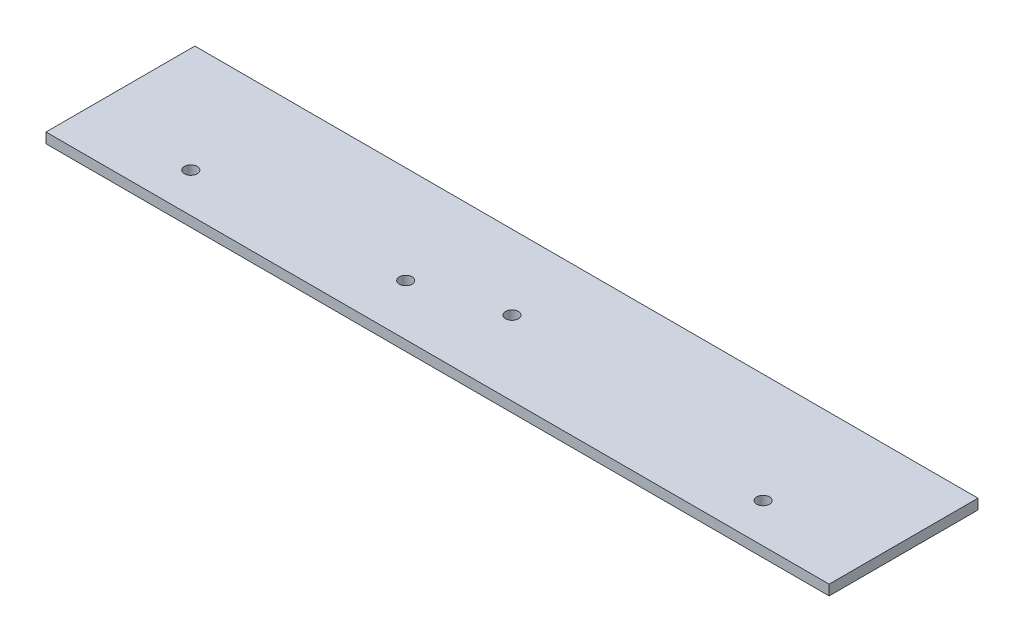
from build123d import *

# Parameters (mm, degrees)
SKETCH1_W           = 194.300874916
SKETCH1_H           = 36.931173376
SKETCH1_R           = 1.5875
BOSS_EXTRUDE1_DEPTH = 1.27


with BuildPart() as part:
    # Sketch1 → Boss-Extrude1 (new, symmetric)
    with BuildSketch(Plane(origin=(0, 0, 0), x_dir=(1, 0, 0), z_dir=(0, 1, 0))):
        Rectangle(SKETCH1_W, SKETCH1_H)
        with Locations(Location((-71, -8.695, 0), (0, 0, 270))):
            Circle(SKETCH1_R, mode=Mode.SUBTRACT)
        with Locations(Location((71, -8.695, 0), (0, 0, 270))):
            Circle(SKETCH1_R, mode=Mode.SUBTRACT)
        with Locations(Location((0, 0, 0), (0, 0, 270))):
            Circle(SKETCH1_R, mode=Mode.SUBTRACT)
        with Locations(Location((-20.62, -5.75, 0), (0, 0, 270))):
            Circle(SKETCH1_R, mode=Mode.SUBTRACT)
    extrude(amount=BOSS_EXTRUDE1_DEPTH, both=True)


solid = part.part
